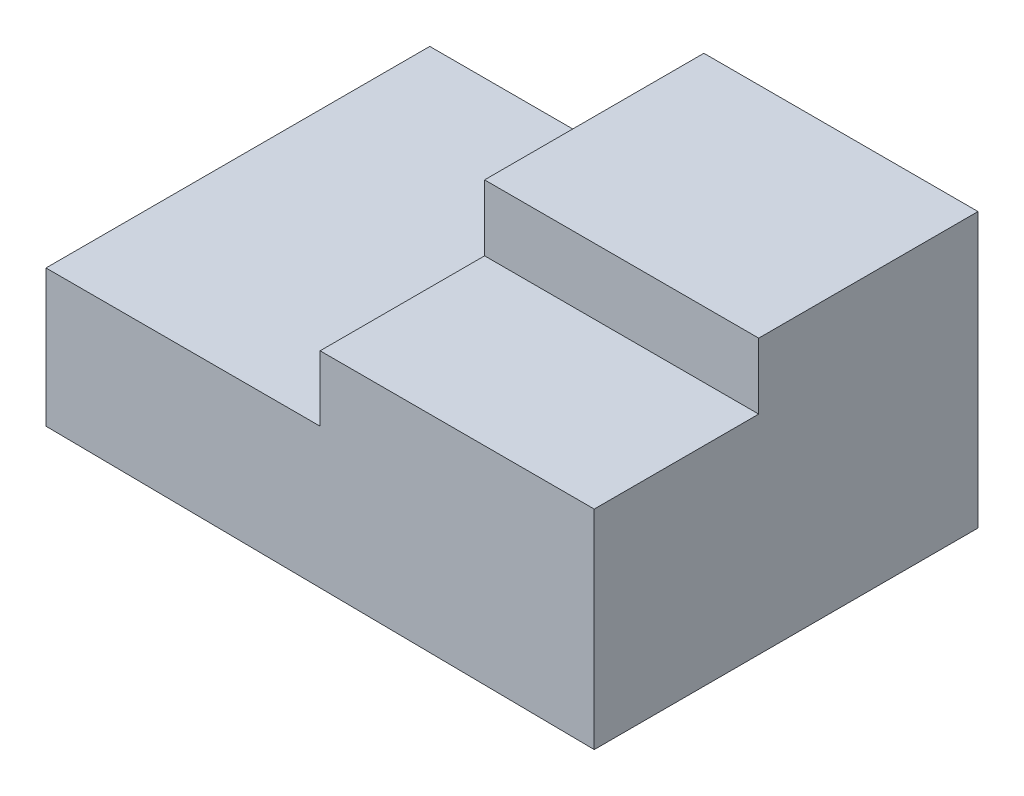
from build123d import *

# Parameters (mm, degrees)
BOSS_EXTRUDE1_DEPTH = 70
SKETCH2_W           = 50
SKETCH2_H           = 40
BOSS_EXTRUDE2_DEPTH = 12


with BuildPart() as part:
    # Sketch1 → Boss-Extrude1 (new body)
    with BuildSketch(Plane.XY):
        Polygon((0, 0), (100, -1.084990958), (100, 36.915009042), (50, 36.915009042), (50, 25), (0, 25), align=None)
    extrude(amount=BOSS_EXTRUDE1_DEPTH)

    # Sketch2 → Boss-Extrude2 (add)
    with BuildSketch(Plane(origin=(0, 36.915009042, 0), x_dir=(1, 0, 0), z_dir=(0, 1, 0))):
        with Locations((75, -20)):
            Rectangle(SKETCH2_W, SKETCH2_H)
    extrude(amount=BOSS_EXTRUDE2_DEPTH)


solid = part.part
